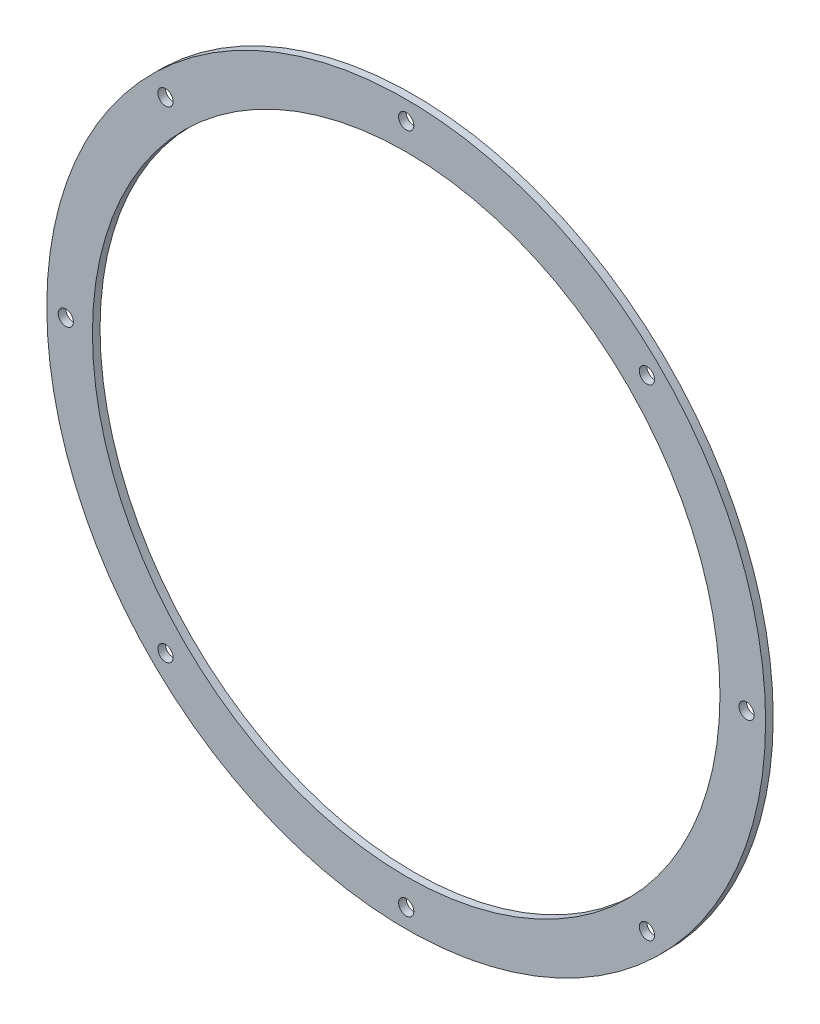
from build123d import *

# Parameters (mm, degrees)
SKETCH1_R           = 94.5
SKETCH1_R_2         = 82.5
SKETCH1_R_3         = 2
BOSS_EXTRUDE1_DEPTH = 2


with BuildPart() as part:
    # Sketch1 → Boss-Extrude1 (new body)
    with BuildSketch(Plane.XY):
        Circle(SKETCH1_R)
        Circle(SKETCH1_R_2, mode=Mode.SUBTRACT)
        with Locations((0, 89.5)):
            Circle(SKETCH1_R_3, mode=Mode.SUBTRACT)
        with Locations((-63.286056916, 63.286056916)):
            Circle(SKETCH1_R_3, mode=Mode.SUBTRACT)
        with Locations((63.286056916, 63.286056916)):
            Circle(SKETCH1_R_3, mode=Mode.SUBTRACT)
        with Locations((89.5, 0)):
            Circle(SKETCH1_R_3, mode=Mode.SUBTRACT)
        with Locations((63.286056916, -63.286056916)):
            Circle(SKETCH1_R_3, mode=Mode.SUBTRACT)
        with Locations((0, -89.5)):
            Circle(SKETCH1_R_3, mode=Mode.SUBTRACT)
        with Locations((-63.286056916, -63.286056916)):
            Circle(SKETCH1_R_3, mode=Mode.SUBTRACT)
        with Locations((-89.5, 0)):
            Circle(SKETCH1_R_3, mode=Mode.SUBTRACT)
    extrude(amount=BOSS_EXTRUDE1_DEPTH)


solid = part.part
